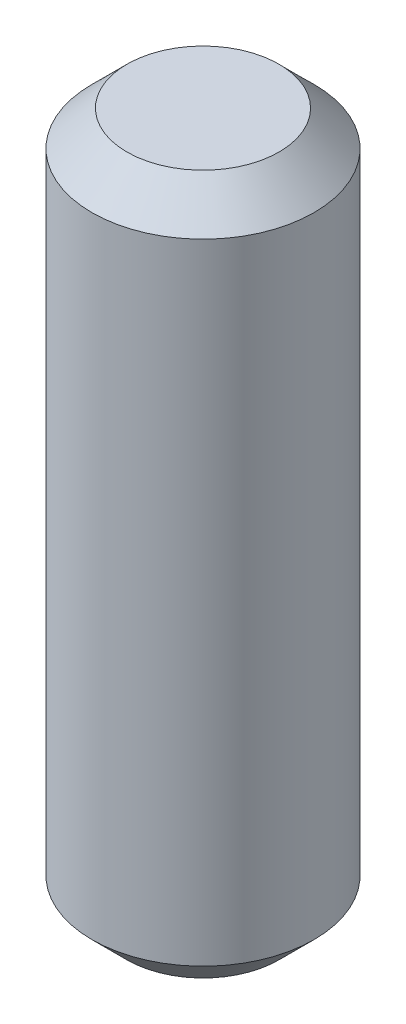
from build123d import *

# Parameters (mm, degrees)
SKETCH1_R           = 1.5875
BOSS_EXTRUDE1_DEPTH = 10
CHAMFER1_SIZE       = 0.5
CHAMFER2_SIZE       = 0.5


with BuildPart() as part:
    # Sketch1 → Boss-Extrude1 (new body)
    with BuildSketch(Plane(origin=(0, 0, 0), x_dir=(1, 0, 0), z_dir=(0, 1, 0))):
        with Locations(Location((0, 0, 0), (0, 0, 270))):
            Circle(SKETCH1_R)
    extrude(amount=BOSS_EXTRUDE1_DEPTH)

    # Chamfer1
    chamfer1_edges = [part.edges().sort_by_distance(p)[0] for p in [
        (0, 10, -1.5875),
    ]]
    chamfer(chamfer1_edges, length=CHAMFER1_SIZE)

    # Chamfer2
    chamfer2_edges = [part.edges().sort_by_distance(p)[0] for p in [
        (0, 0, -1.5875),
    ]]
    chamfer(chamfer2_edges, length=CHAMFER2_SIZE)


solid = part.part
